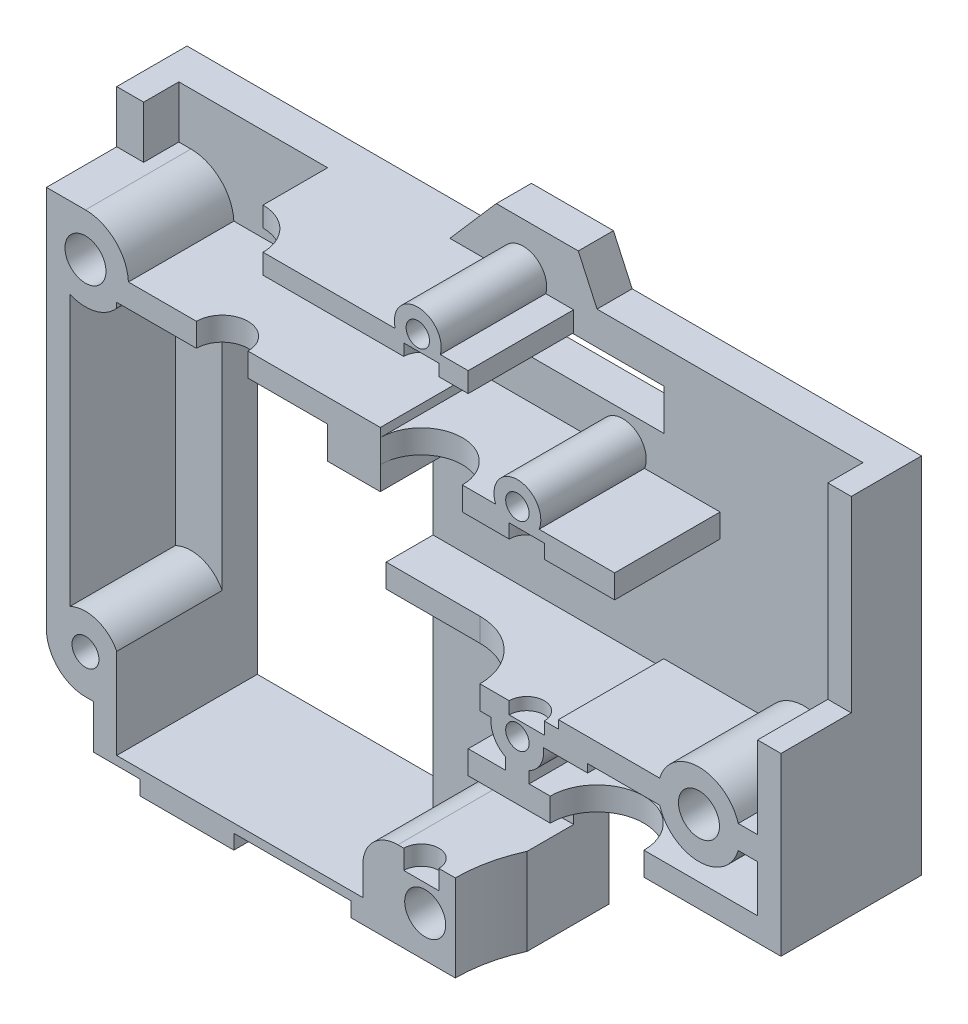
from build123d import *

# Parameters (mm, degrees)
ESQUISSE1_R                   = 1.15
ESQUISSE1_R_2                 = 1.75
ESQUISSE1_R_3                 = 1
ESQUISSE1_W                   = 18
ESQUISSE1_H                   = 33.5
BOSS_EXTRU_2_DEPTH            = 12
ENL_V_MAT_EXTRU_1_DEPTH       = 75.057589753
ESQUISSE3_W                   = 2.3
ESQUISSE3_H                   = 33.5
ESQUISSE3_W_2                 = 2
ESQUISSE3_H_2                 = 16
ENL_V_MAT_EXTRU_2_DEPTH       = 74.753146373
CONG_1_R                      = 3
ENL_V_MAT_EXTRU_3_REACH       = 62.317
ESQUISSE4_R                   = 2.2
ENL_V_MAT_EXTRU_4_REACH       = 67.556
ESQUISSE5_R                   = 3.5
ESQUISSE6_R                   = 3.5
ENL_V_MAT_EXTRU_5_DEPTH       = 5
ESQUISSE7_W                   = 8.040923999
ESQUISSE7_H                   = 1.8
ENL_V_MAT_EXTRU_6_DEPTH       = 1
ENL_V_MAT_EXTRU_7_DEPTH       = 3
ENL_V_MAT_EXTRU_7_DEPTH_BACK  = 75.185757393
ESQUISSE8_W                   = 24.177827552
ESQUISSE8_H                   = 3.5
ENL_V_MAT_EXTRU_8_REACH       = 72.034
ENL_V_MAT_EXTRU_9_REACH       = 76.033
ESQUISSE10_R                  = 4
ESQUISSE11_R                  = 12.099999999
ENL_V_MAT_EXTRU_10_DEPTH      = 76.583950893
ENL_V_MAT_EXTRU_11_DEPTH      = 38
ENL_V_MAT_EXTRU_11_DEPTH_BACK = 1
ESQUISSE17_R                  = 1.5
ENL_V_MAT_EXTRU_12_DEPTH      = 13
ENL_V_MAT_EXTRU_12_DEPTH_BACK = 1.2
ESQUISSE18_R                  = 1.5
ENL_V_MAT_EXTRU_13_DEPTH      = 10


with BuildPart() as part:
    # Esquisse1 → Boss.-Extru.2 (new body)
    with BuildSketch(Plane.XY):
        with BuildLine():
            Line((-12.306087575, 57.58118588), (-12.306087575, 54.58118588))
            Line((-12.306087575, 54.58118588), (12.393912425, 33.08118588))
            Line((12.393912425, 33.08118588), (19.393912425, 33.08118588))
            Line((19.393912425, 33.08118588), (20.993912425, 29.58118588))
            Line((20.993912425, 29.58118588), (45.693912425, 29.58118588))
            Line((45.693912425, 29.58118588), (45.693912425, -1.41881412))
            Line((45.693912425, -1.41881412), (18.993912425, -1.41881412))
            Line((18.993912425, -1.41881412), (18.993912425, -16.91881412))
            Line((18.993912425, -16.91881412), (8.993912425, -16.91881412))
            Line((8.993912425, -16.91881412), (8.993912425, -15.66881412))
            Line((8.993912425, -15.66881412), (-1.006087575, -15.66881412))
            Line((-1.006087575, -15.66881412), (-1.006087575, -16.91881412))
            Line((-1.006087575, -16.91881412), (-9.006087575, -16.91881412))
            Line((-9.006087575, -16.91881412), (-9.006087575, -15.66881412))
            Line((-9.006087575, -15.66881412), (-13.006087575, -15.66881412))
            Line((-13.006087575, -15.66881412), (-13.006087575, -11.91881412))
            Line((-13.006087575, -11.91881412), (-13.676087575, -11.91881412))
            ThreePointArc((-13.676087575, -11.91881412), (-16.030753157, -10.943479702), (-17.006087575, -8.58881412))
            Line((-17.006087575, -8.58881412), (-17.006087575, 57.58118588))
            Line((-17.006087575, 57.58118588), (-12.306087575, 57.58118588))
        make_face()
        with Locations((-13.676087575, -8.58881412)):
            Circle(ESQUISSE1_R, mode=Mode.SUBTRACT)
        with Locations((-13.676087575, 20.41118588)):
            Circle(ESQUISSE1_R_2, mode=Mode.SUBTRACT)
        with Locations((15.323912425, -13.41881412)):
            Circle(ESQUISSE1_R_2, mode=Mode.SUBTRACT)
        with Locations((38.693912425, 5.58118588)):
            Circle(ESQUISSE1_R_2, mode=Mode.SUBTRACT)
        with Locations((23.193912425, 3.58118588)):
            Circle(ESQUISSE1_R_3, mode=Mode.SUBTRACT)
        with Locations((23.193912425, 20.58118588)):
            Circle(ESQUISSE1_R_3, mode=Mode.SUBTRACT)
        with Locations((14.693912425, 29.08118588)):
            Circle(ESQUISSE1_R_3, mode=Mode.SUBTRACT)
        with Locations((-2.006087575, 1.83118588)):
            Rectangle(ESQUISSE1_W, ESQUISSE1_H, mode=Mode.SUBTRACT)
    extrude(amount=BOSS_EXTRU_2_DEPTH)

    # Esquisse2 → Enlèv. mat.-Extru.1 (cut, through all)
    # profile 1 of 4: a face of its own
    with BuildSketch(Plane.XY.offset(3)):
        with BuildLine():
            ThreePointArc((25.047962046, 19.83118588), (23.193912425, 22.58118588), (21.339862803, 19.83118588))
            Line((21.339862803, 19.83118588), (11.493912425, 19.83118588))
            Line((11.493912425, 19.83118588), (11.493912425, 20.58118588))
            Line((11.493912425, 20.58118588), (-10.010027019, 20.58118588))
            ThreePointArc((-10.010027019, 20.58118588), (-11.141822396, 23.065691483), (-13.676087575, 24.08118588))
            Line((-13.676087575, 24.08118588), (-14.706087575, 24.08118588))
            Line((-14.706087575, 24.08118588), (-14.706087575, 57.58118588))
            Line((-14.706087575, 57.58118588), (-12.306087575, 57.58118588))
            Line((-12.306087575, 57.58118588), (-12.306087575, 54.58118588))
            Line((-12.306087575, 54.58118588), (12.393912425, 33.08118588))
            Line((12.393912425, 33.08118588), (19.393912425, 33.08118588))
            Line((19.393912425, 33.08118588), (20.993912425, 29.58118588))
            Line((20.993912425, 29.58118588), (43.693912425, 29.58118588))
            Line((43.693912425, 29.58118588), (43.693912425, 6.58118588))
            Line((43.693912425, 6.58118588), (42.048014391, 6.58118588))
            ThreePointArc((42.048014391, 6.58118588), (38.693912425, 9.08118588), (35.339810458, 6.58118588))
            Line((35.339810458, 6.58118588), (26.693912425, 6.58118588))
            Line((26.693912425, 6.58118588), (26.693912425, 5.88118588))
            Line((26.693912425, 5.88118588), (6.993912425, 5.88118588))
            Line((6.993912425, 5.88118588), (6.993912425, 15.83118588))
            Line((6.993912425, 15.83118588), (11.493912425, 15.83118588))
            Line((11.493912425, 15.83118588), (11.493912425, 17.83118588))
            Line((11.493912425, 17.83118588), (31.493912425, 17.83118588))
            Line((31.493912425, 17.83118588), (31.493912425, 19.83118588))
            Line((31.493912425, 19.83118588), (25.047962046, 19.83118588))
        make_face()
        with BuildLine():
            ThreePointArc((16.616800877, 28.53118588), (14.693912425, 31.08118588), (12.771023972, 28.53118588))
            Line((12.771023972, 28.53118588), (-2.006087575, 28.53118588))
            Line((-2.006087575, 28.53118588), (-2.006087575, 26.83118588))
            Line((-2.006087575, 26.83118588), (18.993912425, 26.83118588))
            Line((18.993912425, 26.83118588), (18.993912425, 28.53118588))
            Line((18.993912425, 28.53118588), (16.616800877, 28.53118588))
        make_face(mode=Mode.SUBTRACT)
    # profile 2 of 4: a face of its own
    with BuildSketch(Plane.XY.offset(3)):
        with BuildLine():
            ThreePointArc((20.964002112, 3.88118588), (21.206819115, 2.52574276), (22.193912425, 1.565621443))
            Line((22.193912425, 1.565621443), (22.193912425, 0.58118588))
            Line((22.193912425, 0.58118588), (18.993912425, 0.58118588))
            Line((18.993912425, 0.58118588), (18.993912425, -9.51881412))
            Line((18.993912425, -9.51881412), (9.993912425, -9.51881412))
            Line((9.993912425, -9.51881412), (9.993912425, -14.91881412))
            Line((9.993912425, -14.91881412), (6.993912425, -14.91881412))
            Line((6.993912425, -14.91881412), (6.993912425, 3.88118588))
            Line((6.993912425, 3.88118588), (20.964002112, 3.88118588))
        make_face()
    # profile 3 of 4: a face of its own
    with BuildSketch(Plane.XY.offset(3)):
        with BuildLine():
            ThreePointArc((-15.006087575, 17.173733177), (-12.847657165, 17.010641356), (-11.006087575, 18.148201125))
            Line((-11.006087575, 18.148201125), (-11.006087575, -7.220932547))
            ThreePointArc((-11.006087575, -7.220932547), (-12.735191712, -5.740180242), (-15.006087575, -5.899743649))
            Line((-15.006087575, -5.899743649), (-15.006087575, 17.173733177))
        make_face()
    # profile 4 of 4: a face of its own
    with BuildSketch(Plane.XY.offset(3)):
        with BuildLine():
            ThreePointArc((24.193912425, 1.565621443), (25.181005734, 2.52574276), (25.423822737, 3.88118588))
            Line((25.423822737, 3.88118588), (29.193912425, 3.88118588))
            Line((29.193912425, 3.88118588), (29.193912425, 4.58118588))
            Line((29.193912425, 4.58118588), (35.339810458, 4.58118588))
            ThreePointArc((35.339810458, 4.58118588), (38.693912425, 2.08118588), (42.048014391, 4.58118588))
            Line((42.048014391, 4.58118588), (43.693912425, 4.58118588))
            Line((43.693912425, 4.58118588), (43.693912425, 0.58118588))
            Line((43.693912425, 0.58118588), (24.193912425, 0.58118588))
            Line((24.193912425, 0.58118588), (24.193912425, 1.565621443))
        make_face()
    extrude(amount=ENL_V_MAT_EXTRU_1_DEPTH, mode=Mode.SUBTRACT)

    # Esquisse3 → Enlèv. mat.-Extru.2 (cut, through all)
    with BuildSketch(Plane.XY.offset(6)):
        with Locations((-15.856087575, 40.83118588)):
            Rectangle(ESQUISSE3_W, ESQUISSE3_H)
        with Locations((44.693912425, 21.58118588)):
            Rectangle(ESQUISSE3_W_2, ESQUISSE3_H_2)
    extrude(amount=ENL_V_MAT_EXTRU_2_DEPTH, mode=Mode.SUBTRACT)

    # Congé1
    cong_1_edges = [part.edges().sort_by_distance(p)[0] for p in [
        (9.993912425, -9.51881412, 7.5),
    ]]
    fillet(cong_1_edges, radius=CONG_1_R)

    # Esquisse4 → Enlèv. mat.-Extru.3 (cut, up to next)
    with BuildSketch(Plane(origin=(0, 20.58118588, 0), x_dir=(1, 0, 0), z_dir=(0, 1, 0)), mode=Mode.PRIVATE) as enl_v_mat_extru_3_sk1:
        with Locations((-2.006087575, -12)):
            Circle(ESQUISSE4_R)
    enl_v_mat_extru_3_tool1 = extrude(enl_v_mat_extru_3_sk1.sketch, amount=-ENL_V_MAT_EXTRU_3_REACH, mode=Mode.PRIVATE) & part.part
    add(enl_v_mat_extru_3_tool1.solids().sort_by_distance((-2.006088, 20.581186, 12))[0], mode=Mode.SUBTRACT)

    # Esquisse5 → Enlèv. mat.-Extru.4 (cut, up to next)
    with BuildSketch(Plane(origin=(0, 28.53118588, 0), x_dir=(1, 0, 0), z_dir=(0, 1, 0)), mode=Mode.PRIVATE) as enl_v_mat_extru_4_sk1:
        with Locations((-2.017786304, -12.014313461)):
            Circle(ESQUISSE5_R)
    enl_v_mat_extru_4_tool1 = extrude(enl_v_mat_extru_4_sk1.sketch, amount=-ENL_V_MAT_EXTRU_4_REACH, mode=Mode.PRIVATE) & part.part
    add(enl_v_mat_extru_4_tool1.solids().sort_by_distance((-2.017786, 28.531186, 12.014313))[0], mode=Mode.SUBTRACT)

    # Esquisse6 → Enlèv. mat.-Extru.5 (cut)
    with BuildSketch(Plane(origin=(0, 19.83118588, 0), x_dir=(1, 0, 0), z_dir=(0, 1, 0))):
        with Locations((14.993912425, -12)):
            Circle(ESQUISSE6_R)
    extrude(amount=-ENL_V_MAT_EXTRU_5_DEPTH, mode=Mode.SUBTRACT)

    # Esquisse7 → Enlèv. mat.-Extru.6 (cut)
    with BuildSketch(Plane.XY.offset(3)):
        with Locations((2.077482888, 31.18118588)):
            Rectangle(ESQUISSE7_W, ESQUISSE7_H)
    extrude(amount=-ENL_V_MAT_EXTRU_6_DEPTH, mode=Mode.SUBTRACT)

    # Esquisse8 → Enlèv. mat.-Extru.7 (cut, two sides: drawn at the far end of the back side and taken through both)
    with BuildSketch(Plane.XY.offset(2).offset(-ENL_V_MAT_EXTRU_7_DEPTH_BACK)):
        with Locations((14.607691418, 24.992571009)):
            Rectangle(ESQUISSE8_W, ESQUISSE8_H)
    extrude(amount=ENL_V_MAT_EXTRU_7_DEPTH + ENL_V_MAT_EXTRU_7_DEPTH_BACK, mode=Mode.SUBTRACT)

    # Esquisse9 → Enlèv. mat.-Extru.8 (cut, up to next)
    with BuildSketch(Plane(origin=(0, 5.88118588, 0), x_dir=(1, 0, 0), z_dir=(0, 1, 0)), mode=Mode.PRIVATE) as enl_v_mat_extru_8_sk1:
        with BuildLine():
            Line((14.993912425, -7), (6.993912425, -7))
            Line((6.993912425, -7), (6.993912425, -12))
            Line((6.993912425, -12), (19.993912425, -12))
            ThreePointArc((19.993912425, -12), (18.529446331, -8.464466094), (14.993912425, -7))
        make_face()
    enl_v_mat_extru_8_tool1 = extrude(enl_v_mat_extru_8_sk1.sketch, amount=-ENL_V_MAT_EXTRU_8_REACH, mode=Mode.PRIVATE) & part.part
    add(enl_v_mat_extru_8_tool1.solids().sort_by_distance((13.009618, 5.881186, 9.624436))[0], mode=Mode.SUBTRACT)

    # Esquisse10 → Enlèv. mat.-Extru.9 (cut, up to next)
    with BuildSketch(Plane(origin=(0, 0.58118588, 0), x_dir=(1, 0, 0), z_dir=(0, 1, 0)), mode=Mode.PRIVATE) as enl_v_mat_extru_9_sk1:
        with Locations((29.993912425, -12)):
            Circle(ESQUISSE10_R)
    enl_v_mat_extru_9_tool1 = extrude(enl_v_mat_extru_9_sk1.sketch, amount=-ENL_V_MAT_EXTRU_9_REACH, mode=Mode.PRIVATE) & part.part
    add(enl_v_mat_extru_9_tool1.solids().sort_by_distance((29.993912, 0.581186, 12))[0], mode=Mode.SUBTRACT)

    # Esquisse11 → Enlèv. mat.-Extru.10 (cut, through all)
    with BuildSketch(Plane.XZ.offset(1.41881412)):
        with Locations((29.993912425, 12)):
            Circle(ESQUISSE11_R)
    extrude(amount=ENL_V_MAT_EXTRU_10_DEPTH, mode=Mode.SUBTRACT)

    # Esquisse17 → Enlèv. mat.-Extru.11 (cut, two sides: drawn at the far end of the back side and taken through both)
    with BuildSketch(Plane.XZ.offset(-26.83118588).offset(-ENL_V_MAT_EXTRU_11_DEPTH_BACK)):
        with Locations((14.993912425, 12)):
            Circle(ESQUISSE17_R)
    extrude(amount=ENL_V_MAT_EXTRU_11_DEPTH + ENL_V_MAT_EXTRU_11_DEPTH_BACK, mode=Mode.SUBTRACT)

    # Esquisse18 → Enlèv. mat.-Extru.12 (cut, two sides: drawn at the far end of the back side and taken through both)
    with BuildSketch(Plane.XZ.offset(-17.83118588).offset(-ENL_V_MAT_EXTRU_12_DEPTH_BACK)):
        with Locations((23.993912425, 12)):
            Circle(ESQUISSE18_R)
    extrude(amount=ENL_V_MAT_EXTRU_12_DEPTH + ENL_V_MAT_EXTRU_12_DEPTH_BACK, mode=Mode.SUBTRACT)

    # Esquisse19 → Enlèv. mat.-Extru.13 (cut)
    with BuildSketch(Plane.XY.offset(6)):
        Polygon((12.393912425, 33.08118588), (-12.306087575, 54.58118588), (-12.306087575, 57.58118588), (-14.706087575, 57.58118588), (-17.006087575, 57.58118588), (-17.006087575, 28.53118588), (8.433386109, 28.53118588), align=None)
    extrude(amount=-ENL_V_MAT_EXTRU_13_DEPTH, mode=Mode.SUBTRACT)


solid = part.part
